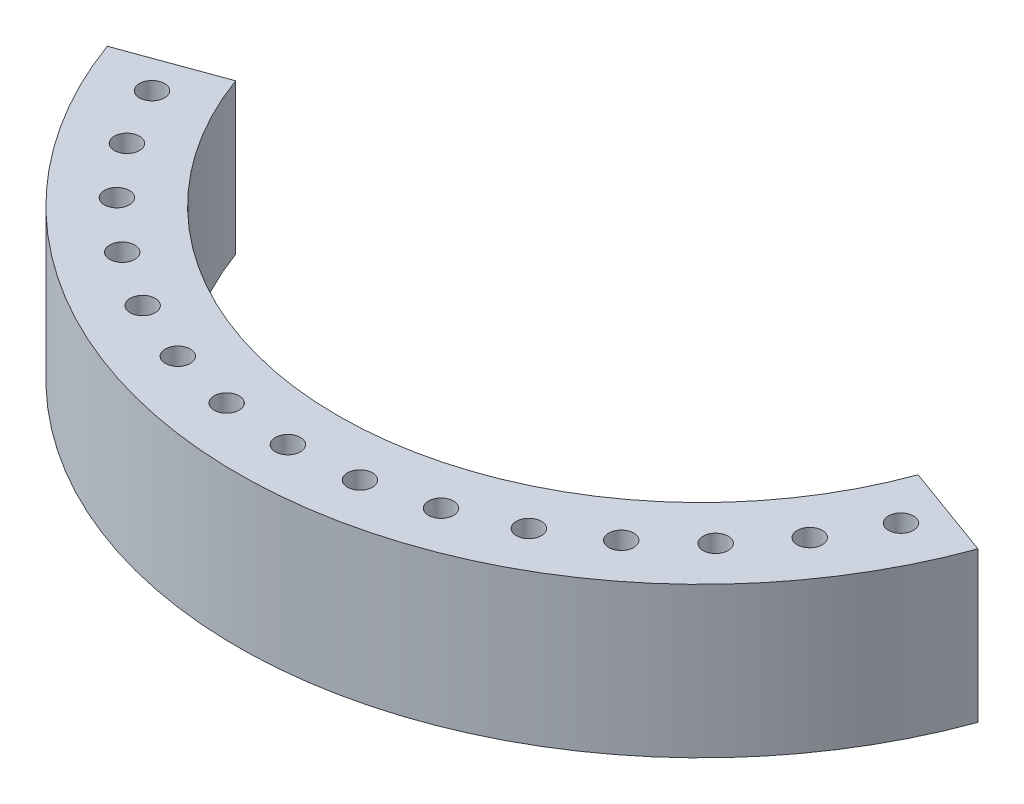
from build123d import *

# Parameters (mm, degrees)
BOSS_EXTRUDE1_DEPTH        = 38.1
F_1_4_0_2500_DOWEL_HOLE1_D = 6.35
CIRPATTERN1_COUNT          = 8
CIRPATTERN1_ANGLE          = 65
MIRROR1_COPY_1_D           = 6.35
MIRROR1_COPY_2_D           = 6.35
MIRROR1_COPY_3_D           = 6.35
MIRROR1_COPY_4_D           = 6.35
MIRROR1_COPY_5_D           = 6.35
MIRROR1_COPY_6_D           = 6.35
MIRROR1_COPY_7_D           = 6.35
MIRROR1_COPY_8_D           = 6.35


with BuildPart() as part:
    # Sketch1 → Boss-Extrude1 (new body)
    with BuildSketch(Plane(origin=(0, 0, 0), x_dir=(1, 0, 0), z_dir=(0, 1, 0))):
        with BuildLine():
            Line((-110.390390627, -40.178816337), (-86.522198059, -31.491504697))
            ThreePointArc((-86.522198059, -31.491504697), (0, -92.075), (86.522198059, -31.491504697))
            Line((86.522198059, -31.491504697), (110.390390627, -40.178816337))
            ThreePointArc((110.390390627, -40.178816337), (0, -117.475), (-110.390390627, -40.178816337))
        make_face()
    extrude(amount=-BOSS_EXTRUDE1_DEPTH)

    # 1/4 (0.2500) Dowel Hole1 (through all)
    with Locations(Plane(origin=(0, 0, 0), x_dir=(1, 0, 0), z_dir=(0, 1, 0))):
        with Locations((0, -104.775)):
            f_1_4_0_2500_dowel_hole1 = Hole(F_1_4_0_2500_DOWEL_HOLE1_D / 2)

    # CirPattern1: 1/4 (0.2500) Dowel Hole1 ×8 about axis
    cirpattern1_axis = Axis((0, 0, 0), (0, -1, 0))
    for i in range(1, CIRPATTERN1_COUNT):
        add(f_1_4_0_2500_dowel_hole1.rotate(cirpattern1_axis, i * CIRPATTERN1_ANGLE / (CIRPATTERN1_COUNT - 1)), mode=Mode.SUBTRACT)

    # Mirror1 copy 1 (through all)
    with Locations(Plane(origin=(0, 0, 0), x_dir=(-0.9868959788567211, 0, 0.161357760632807), z_dir=(0, 1, 0))):
        with Locations((0, 104.775)):
            Hole(MIRROR1_COPY_1_D / 2)

    # Mirror1 copy 2 (through all)
    with Locations(Plane(origin=(0, 0, 0), x_dir=(-0.9479273461671315, 0, 0.3184866502516851), z_dir=(0, 1, 0))):
        with Locations((0, 104.775)):
            Hole(MIRROR1_COPY_2_D / 2)

    # Mirror1 copy 3 (through all)
    with Locations(Plane(origin=(0, 0, 0), x_dir=(-0.8841153935046093, 0, 0.4672686282730629), z_dir=(0, 1, 0))):
        with Locations((0, 104.775)):
            Hole(MIRROR1_COPY_3_D / 2)

    # Mirror1 copy 4 (through all)
    with Locations(Plane(origin=(0, 0, 0), x_dir=(-0.7971325072229216, 0, 0.6038044103254785), z_dir=(0, 1, 0))):
        with Locations((0, 104.775)):
            Hole(MIRROR1_COPY_4_D / 2)

    # Mirror1 copy 5 (through all)
    with Locations(Plane(origin=(0, 0, 0), x_dir=(-0.6892583384839459, 0, 0.7245156608592739), z_dir=(0, 1, 0))):
        with Locations((0, 104.775)):
            Hole(MIRROR1_COPY_5_D / 2)

    # Mirror1 copy 6 (through all)
    with Locations(Plane(origin=(0, 0, 0), x_dir=(-0.5633200580636203, 0, 0.8262387743159961), z_dir=(0, 1, 0))):
        with Locations((0, 104.775)):
            Hole(MIRROR1_COPY_6_D / 2)

    # Mirror1 copy 7 (through all)
    with Locations(Plane(origin=(0, 0, 0), x_dir=(-0.4226182617406972, 0, 0.906307787036651), z_dir=(0, 1, 0))):
        with Locations((0, 104.775)):
            Hole(MIRROR1_COPY_7_D / 2)

    # Mirror1 copy 8 (through all)
    with Locations(Plane(origin=(0, 0, 0), x_dir=(-1, 0, 0), z_dir=(0, 1, 0))):
        with Locations((0, 104.775)):
            Hole(MIRROR1_COPY_8_D / 2)


solid = part.part
